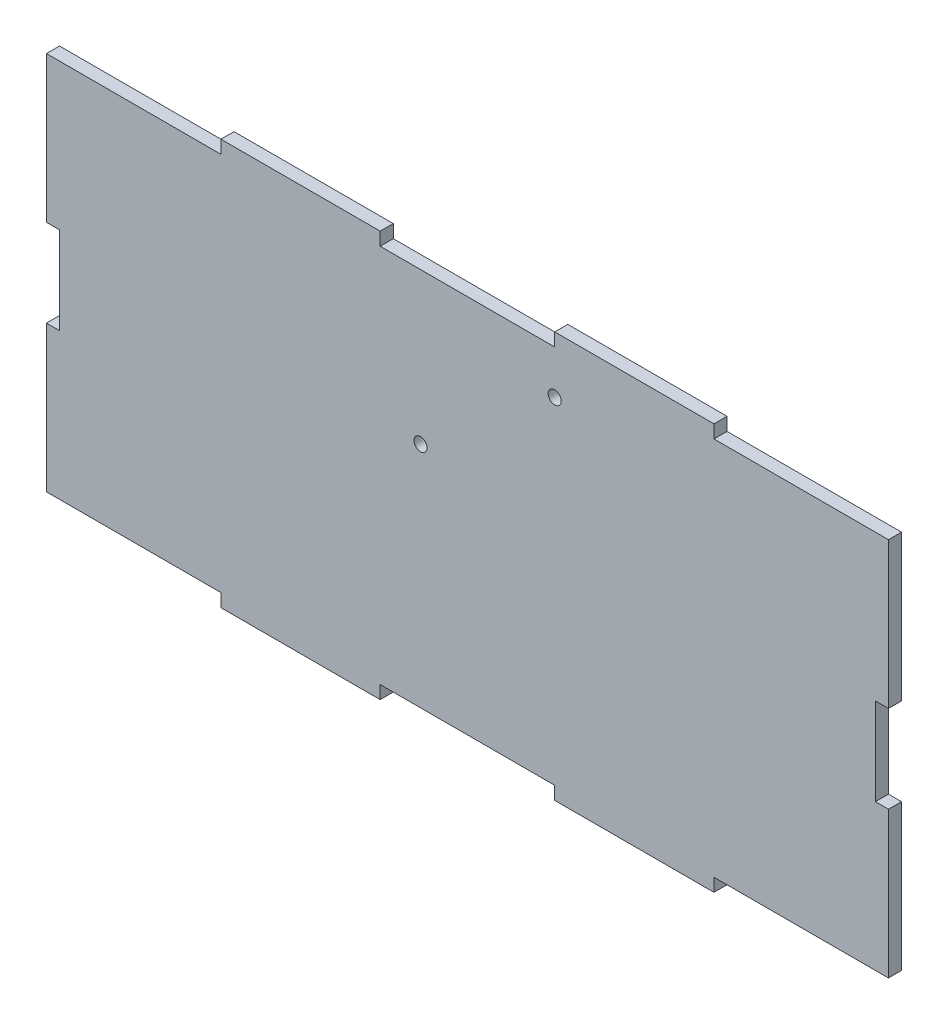
from build123d import *

# Parameters (mm, degrees)
SKETCH2_W           = 193
SKETCH2_H           = 93
BOSS_EXTRUDE1_DEPTH = 3
SKETCH3_R           = 1.5
SKETCH3_W           = 40
SKETCH3_H           = 3
SKETCH3_W_2         = 3
SKETCH3_H_2         = 20
CUT_EXTRUDE1_DEPTH  = 3


with BuildPart() as part:
    # Sketch2 → Boss-Extrude1 (new body)
    with BuildSketch(Plane.XY):
        Rectangle(SKETCH2_W, SKETCH2_H)
    extrude(amount=BOSS_EXTRUDE1_DEPTH)

    # Sketch3 → Cut-Extrude1 (cut)
    with BuildSketch(Plane(origin=(0, 0, 0), x_dir=(-1, 0, 0), z_dir=(0, 0, -1))):
        with Locations((-20, 33.5)):
            Circle(SKETCH3_R)
        with Locations((10.759, 8.837)):
            Circle(SKETCH3_R)
        with Locations((-76.5, 45)):
            Rectangle(SKETCH3_W, SKETCH3_H)
        with Locations((76.5, -45)):
            Rectangle(SKETCH3_W, SKETCH3_H)
        with Locations((76.5, 45)):
            Rectangle(SKETCH3_W, SKETCH3_H)
        with Locations((0, 45)):
            Rectangle(SKETCH3_W, SKETCH3_H)
        with Locations((0, -45)):
            Rectangle(SKETCH3_W, SKETCH3_H)
        with Locations((-76.5, -45)):
            Rectangle(SKETCH3_W, SKETCH3_H)
        with Locations((95, 0)):
            Rectangle(SKETCH3_W_2, SKETCH3_H_2)
        with Locations((-95, 0)):
            Rectangle(SKETCH3_W_2, SKETCH3_H_2)
    extrude(amount=-CUT_EXTRUDE1_DEPTH, mode=Mode.SUBTRACT)


solid = part.part
